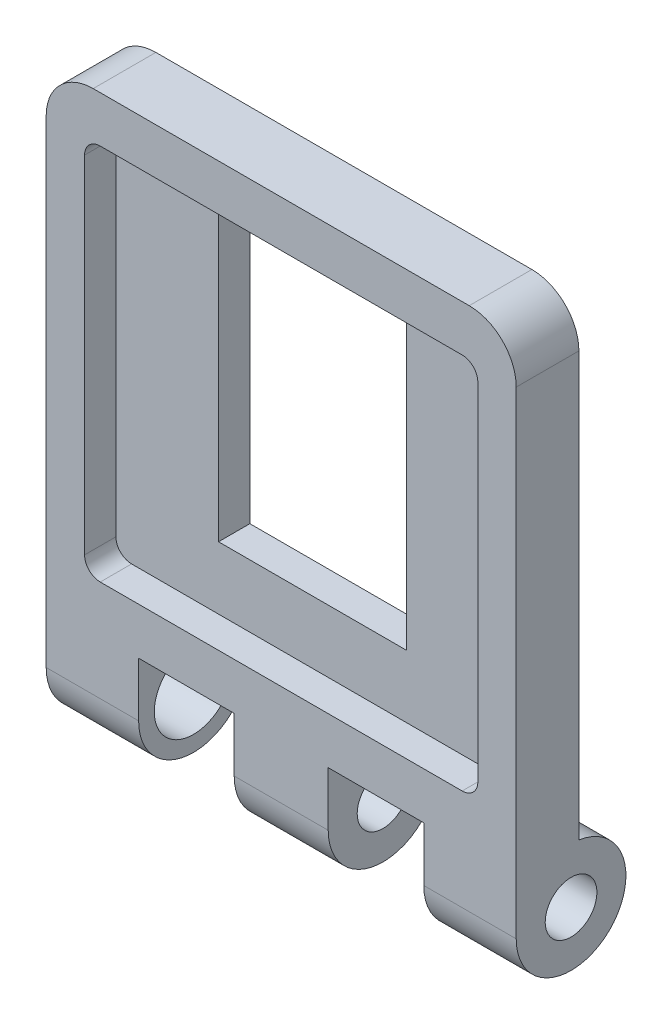
from build123d import *

# Parameters (mm, degrees)
SALIENTE_EXTRUIR1_DEPTH    = 2
SALIENTE_EXTRUIR2_DEPTH    = 4
CROQUIS2_R                 = 1.65
SALIENTE_EXTRUIR3_DEPTH    = 30
CORTAR_EXTRUIR1_DEPTH      = 27.925824036
CORTAR_EXTRUIR1_DEPTH_BACK = 27.925824036
CROQUIS3_W                 = 6.1
CROQUIS3_H                 = 6.964101615
CORTAR_EXTRUIR3_START      = -30
CROQUIS2_3_R               = 2.5
CROQUIS2_3_R_2             = 1.65
CORTAR_EXTRUIR3_DEPTH      = 5.9


with BuildPart() as part:
    # Croquis1 → Saliente-Extruir1 (new body)
    with BuildSketch(Plane.XY):
        with BuildLine():
            Line((-6, 12.05), (-11.55, 12.05))
            ThreePointArc((-11.55, 12.05), (-12.257106781, 11.757106781), (-12.55, 11.05))
            Line((-12.55, 11.05), (-12.55, -11.05))
            ThreePointArc((-12.55, -11.05), (-12.257106781, -11.757106781), (-11.55, -12.05))
            Line((-11.55, -12.05), (11.55, -12.05))
            ThreePointArc((11.55, -12.05), (12.257106781, -11.757106781), (12.55, -11.05))
            Line((12.55, -11.05), (12.55, 11.05))
            ThreePointArc((12.55, 11.05), (12.257106781, 11.757106781), (11.55, 12.05))
            Line((11.55, 12.05), (6, 12.05))
            Line((6, 12.05), (6, -8.05))
            Line((6, -8.05), (-6, -8.05))
            Line((-6, -8.05), (-6, 12.05))
        make_face()
    extrude(amount=SALIENTE_EXTRUIR1_DEPTH)

    # Croquis1<3> → Saliente-Extruir2 (add)
    with BuildSketch(Plane.XY):
        with BuildLine():
            Line((-12, 15), (12, 15))
            ThreePointArc((12, 15), (14.121320344, 14.121320344), (15, 12))
            Line((15, 12), (15, -15))
            Line((15, -15), (-15, -15))
            Line((-15, -15), (-15, 12))
            ThreePointArc((-15, 12), (-14.121320344, 14.121320344), (-12, 15))
        make_face()
        with BuildLine():
            Line((-11.55, 12.05), (11.55, 12.05))
            ThreePointArc((11.55, 12.05), (12.257106781, 11.757106781), (12.55, 11.05))
            Line((12.55, 11.05), (12.55, -11.05))
            ThreePointArc((12.55, -11.05), (12.257106781, -11.757106781), (11.55, -12.05))
            Line((11.55, -12.05), (-11.55, -12.05))
            ThreePointArc((-11.55, -12.05), (-12.257106781, -11.757106781), (-12.55, -11.05))
            Line((-12.55, -11.05), (-12.55, 11.05))
            ThreePointArc((-12.55, 11.05), (-12.257106781, 11.757106781), (-11.55, 12.05))
        make_face(mode=Mode.SUBTRACT)
    extrude(amount=SALIENTE_EXTRUIR2_DEPTH)

    # Croquis2 → Saliente-Extruir3 (add)
    with BuildSketch(Plane(origin=(15, 0, 0), x_dir=(0, 0, -1), z_dir=(1, 0, 0))):
        with BuildLine():
            Line((0, -15.035898385), (0, -15))
            Line((0, -15), (-4, -15))
            Line((-4, -15), (-4, -18.5))
            ThreePointArc((-4, -18.5), (1.791287847, -21.145751311), (0, -15.035898385))
        make_face()
        with Locations(Location((-0.5, -18.5, 0), (0, 0, 90))):
            Circle(CROQUIS2_R, mode=Mode.SUBTRACT)
    extrude(amount=-SALIENTE_EXTRUIR3_DEPTH)

    # Croquis3 → Cortar-Extruir1 (cut, two sides: drawn at the far end of the back side and taken through both)
    with BuildSketch(Plane.XY.offset(-CORTAR_EXTRUIR1_DEPTH_BACK)):
        with Locations((-6.05, -18.517949193)):
            Rectangle(CROQUIS3_W, CROQUIS3_H)
        with Locations((6.05, -18.517949193)):
            Rectangle(CROQUIS3_W, CROQUIS3_H)
    extrude(amount=CORTAR_EXTRUIR1_DEPTH + CORTAR_EXTRUIR1_DEPTH_BACK, mode=Mode.SUBTRACT)

    # Croquis2<3> → Cortar-Extruir3 (cut)
    with BuildSketch(Plane(origin=(15, 0, 0), x_dir=(0, 0, -1), z_dir=(1, 0, 0)).offset(CORTAR_EXTRUIR3_START)):
        with Locations(Location((-0.5, -18.5, 0), (0, 0, 180))):
            Circle(CROQUIS2_3_R)
        with Locations(Location((-0.5, -18.5, 0), (0, 0, 90))):
            Circle(CROQUIS2_3_R_2, mode=Mode.SUBTRACT)
    extrude(amount=CORTAR_EXTRUIR3_DEPTH, mode=Mode.SUBTRACT)


solid = part.part
